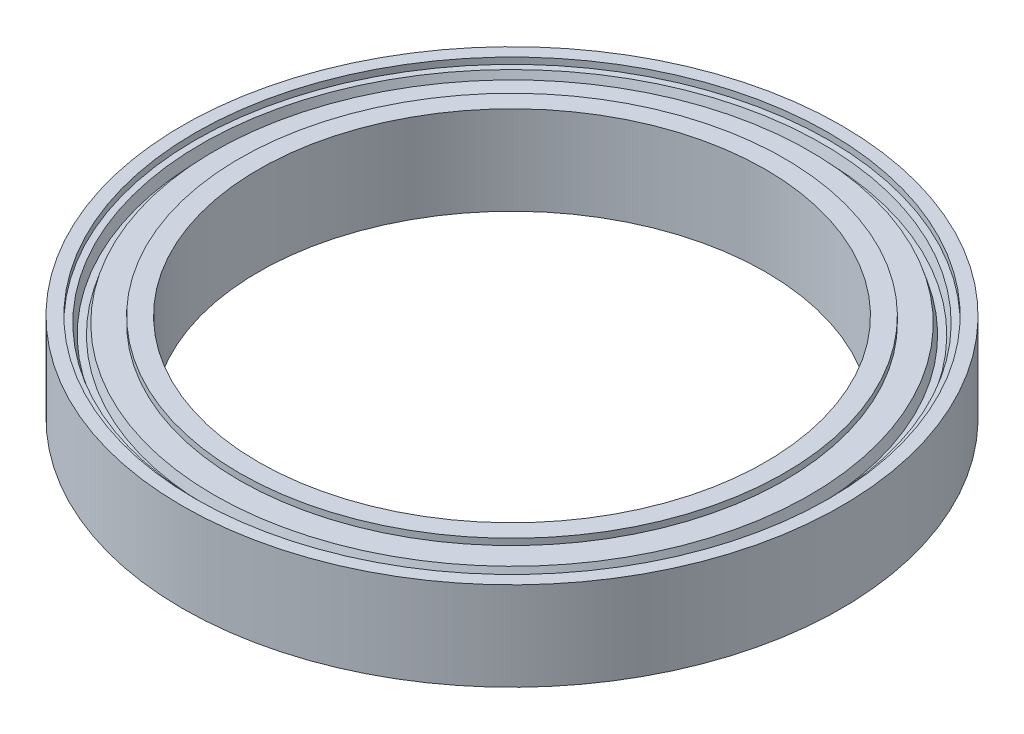
from build123d import *

# Parameters (mm, degrees)
SKETCH_1_R          = 26
SKETCH_1_R_2        = 20
EXTRUDE_1_DEPTH     = 7
SKETCH_2_R          = 25
SKETCH_2_R_2        = 21.5
CUT_EXTRUDE_1_DEPTH = 0.5
SKETCH_3_R          = 24.5
SKETCH_3_R_2        = 23.5
CUT_EXTRUDE_2_DEPTH = 0.8
CUT_EXTRUDE_2_DRAFT = -17
CUT_EXTRUDE_START   = -0.5
SKETCH_4_R          = 24.5
SKETCH_4_R_2        = 21.5
CUT_EXTRUDE_3_DEPTH = 0.5


with BuildPart() as part:
    # Эскиз1 → Бобышка-Вытянуть1 (new body)
    with BuildSketch(Plane(origin=(0, 0, 0), x_dir=(1, 0, 0), z_dir=(0, 1, 0))):
        with Locations(Location((0, 0, 0), (0, 0, 270))):
            Circle(SKETCH_1_R)
        with Locations(Location((0, 0, 0), (0, 0, 270))):
            Circle(SKETCH_1_R_2, mode=Mode.SUBTRACT)
    extrude(amount=EXTRUDE_1_DEPTH)

    # Эскиз2 → Вырез-Вытянуть1 (cut)
    with BuildSketch(Plane(origin=(0, 7, 0), x_dir=(1, 0, 0), z_dir=(0, 1, 0))):
        with Locations(Location((0, 0, 0), (0, 0, 270))):
            Circle(SKETCH_2_R)
        with Locations(Location((0, 0, 0), (0, 0, 270))):
            Circle(SKETCH_2_R_2, mode=Mode.SUBTRACT)
    extrude(amount=-CUT_EXTRUDE_1_DEPTH, mode=Mode.SUBTRACT)


with BuildPart() as cut_extrude_2_tool:
    # Эскиз3 → Вырез-Вытянуть2 (with draft: the straight prism first)
    with BuildSketch(Plane(origin=(0, 6.5, 0), x_dir=(1, 0, 0), z_dir=(0, 1, 0))):
        Circle(SKETCH_3_R)
        Circle(SKETCH_3_R_2, mode=Mode.SUBTRACT)
    extrude(amount=-CUT_EXTRUDE_2_DEPTH)
    # Вырез-Вытянуть2: the draft: its side faces are tilted about the plane it starts from
    cut_extrude_2_sides = [cut_extrude_2_tool.faces().sort_by_distance(p)[0] for p in [
        (-24.5, 6.1, 0),
        (-23.5, 6.1, 0),
    ]]
    draft(cut_extrude_2_sides, Plane(origin=(0, 6.5, 0), x_dir=(1, 0, 0), z_dir=(0, 1, 0)), CUT_EXTRUDE_2_DRAFT)


with BuildPart() as part_1:
    add(part.part)

    # Вырез-Вытянуть2: cut by cut_extrude_2_tool
    add(cut_extrude_2_tool.part, mode=Mode.SUBTRACT)

    # Эскиз4 → Вырез-Вытянуть3 (cut)
    with BuildSketch(Plane.XZ.offset(CUT_EXTRUDE_START)):
        with Locations(Location((0, 0, 0), (0, 0, 270))):
            Circle(SKETCH_4_R)
        with Locations(Location((0, 0, 0), (0, 0, 90))):
            Circle(SKETCH_4_R_2, mode=Mode.SUBTRACT)
    extrude(amount=CUT_EXTRUDE_3_DEPTH, mode=Mode.SUBTRACT)


solid = part_1.part
